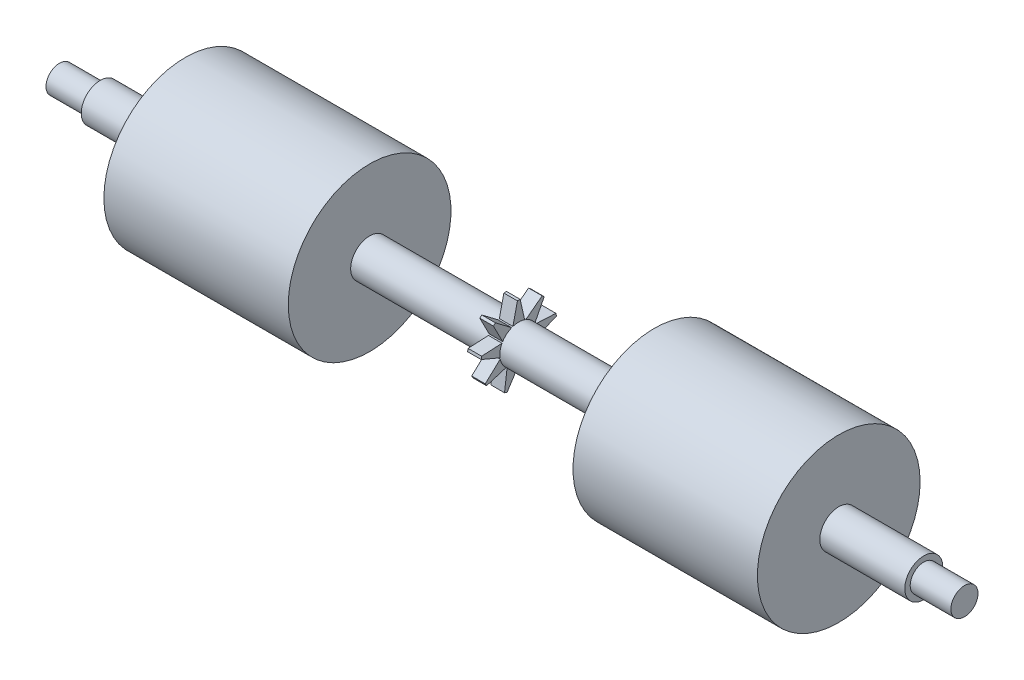
from build123d import *

# Parameters (mm, degrees)
BOSS_EXTRU_2_DEPTH      = 151.845
BOSS_EXTRU_2_DEPTH_BACK = 151.845
ESQUISSE1_R             = 7
ESQUISSE3_W             = 68
ESQUISSE3_H             = 30
ESQUISSE3_H_2           = 35
ESQUISSE4_R             = 5
BOSS_EXTRU_3_DEPTH      = 15
BOSS_EXTRU_4_START      = 15
ESQUISSE5_R             = 5
BOSS_EXTRU_4_DEPTH      = 15
BOSS_EXTRU_6_DEPTH      = 2.5
BOSS_EXTRU_6_DEPTH_BACK = 2.5
ENL_V_START             = -68
ESQUISSE11_R            = 35
ESQUISSE11_R_2          = 30
ENL_V_MAT_EXTRU_1_DEPTH = 68


with BuildPart() as part:
    # Esquisse1 → Boss.-Extru.2 (new, two sides: drawn at the far end of the back side and taken through both)
    with BuildSketch(Plane(origin=(0, 0, 0), x_dir=(0, 0, -1), z_dir=(1, 0, 0)).offset(-BOSS_EXTRU_2_DEPTH_BACK)):
        Circle(ESQUISSE1_R)
    extrude(amount=BOSS_EXTRU_2_DEPTH + BOSS_EXTRU_2_DEPTH_BACK)

    # Esquisse3 → Révolution2 (revolve)
    with BuildSketch(Plane.XY, mode=Mode.PRIVATE) as r_volution2_sk:
        with Locations((-86.5, 15)):
            Rectangle(ESQUISSE3_W, ESQUISSE3_H)
        with Locations((86.5, 17.5)):
            Rectangle(ESQUISSE3_W, ESQUISSE3_H_2)
    revolve(r_volution2_sk.sketch.rotate(Axis((-120.5, 0, 0), (1, 0, 0)), 270), axis=Axis((-120.5, 0, 0), (1, 0, 0)))

    # Esquisse4 → Boss.-Extru.3 (add)
    with BuildSketch(Plane.ZY.offset(151.845)):
        Circle(ESQUISSE4_R)
    extrude(amount=BOSS_EXTRU_3_DEPTH)

    # Esquisse5 → Boss.-Extru.4 (add)
    with BuildSketch(Plane(origin=(151.845, 0, 0), x_dir=(0, 0, -1), z_dir=(1, 0, 0)).offset(BOSS_EXTRU_4_START)):
        with Locations(Location((0, 0, 0), (0, 0, 180))):
            Circle(ESQUISSE5_R)
    extrude(amount=-BOSS_EXTRU_4_DEPTH)

    # Esquisse6 → Boss.-Extru.6 (add, two sides: drawn at the far end of the back side and taken through both)
    with BuildSketch(Plane(origin=(0, 0, 0), x_dir=(0, 0, -1), z_dir=(1, 0, 0)).offset(-BOSS_EXTRU_6_DEPTH_BACK)):
        Polygon((-0.495363477, 14), (-2.169953885, 6.655170932), (-2.610793017, 6.495072622), (-8.616105681, 11.046145282), (-9.378598341, 10.406337972), (-5.940243898, 3.703466513), (-6.175037056, 3.29745816), (-13.700746567, 2.923641509), (-13.873589621, 1.94339984), (-6.931134583, -0.98116596), (-6.850019438, -1.443108535), (-12.374762678, -6.566901532), (-11.87708094, -7.428911588), (-4.678977177, -5.206734889), (-4.319908407, -5.508463622), (-5.258596613, -12.984753276), (-4.323260899, -13.325187635), (-0.237581159, -6.99604961), (0.231428968, -6.996382273), (4.31801844, -13.326929566), (5.253354154, -12.986495207), (4.314874913, -5.51186988), (4.674371346, -5.210650816), (11.874077864, -7.433322313), (12.371759603, -6.571312256), (6.848246248, -1.448659888), (6.93001661, -0.986832845), (13.87401748, 1.938384149), (13.701174426, 2.918625818), (6.177140243, 3.292359253), (5.942923274, 3.698700268), (9.382043313, 10.403064212), (8.619550653, 11.042871522), (2.615574856, 6.492811995), (2.174963279, 6.653535506), (0.5, 14), align=None)
    extrude(amount=BOSS_EXTRU_6_DEPTH + BOSS_EXTRU_6_DEPTH_BACK)

    # Esquisse11 → Enlèv. mat.-Extru.1 (cut)
    with BuildSketch(Plane(origin=(120.5, 0, 0), x_dir=(0, 0, -1), z_dir=(1, 0, 0)).offset(ENL_V_START)):
        Circle(ESQUISSE11_R)
        with Locations(Location((0, 0, 0), (0, 0, 180))):
            Circle(ESQUISSE11_R_2, mode=Mode.SUBTRACT)
    extrude(amount=ENL_V_MAT_EXTRU_1_DEPTH, mode=Mode.SUBTRACT)


solid = part.part
